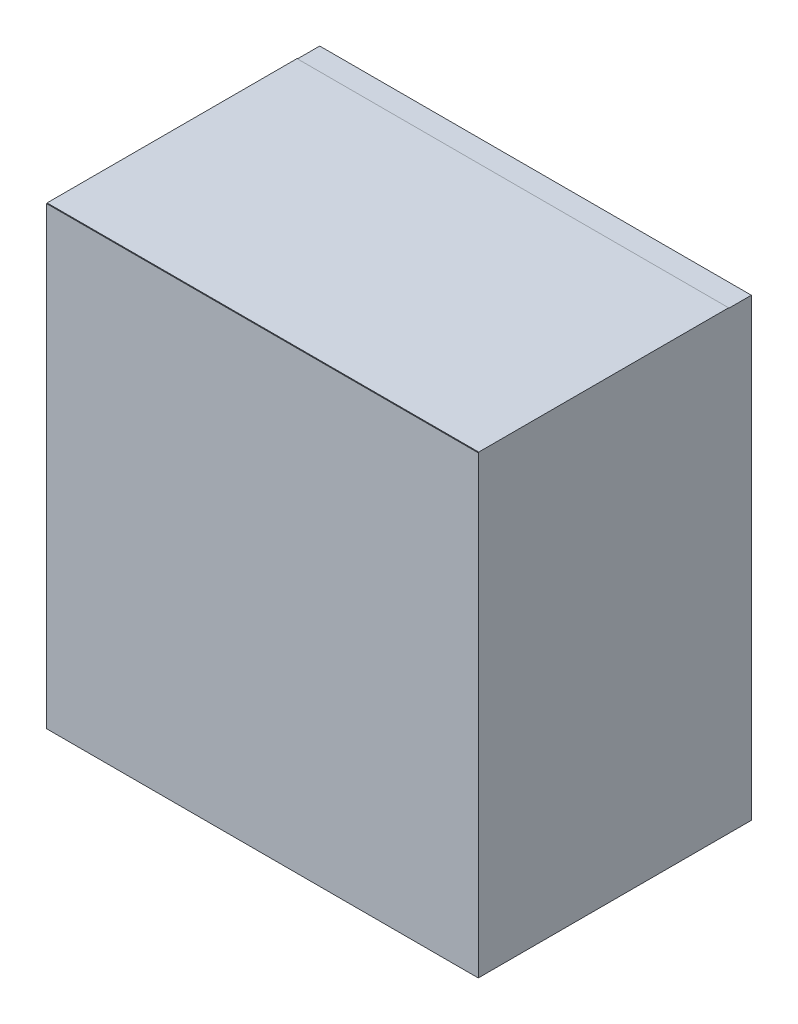
from build123d import *

# Parameters (mm, degrees)
SKETCH_1_W      = 950
SKETCH_1_H      = 550
EXTRUDE_1_DEPTH = 1
SKETCH_2_W      = 950
SKETCH_2_H      = 550
EXTRUDE_2_DEPTH = 1
SKETCH_3_W      = 950
SKETCH_3_H      = 1001
EXTRUDE_3_DEPTH = 1
SKETCH_3_2_W    = 950
SKETCH_3_2_H    = 1001
EXTRUDE_4_DEPTH = 600


with BuildPart() as part:
    # 草图1 → 凸台-拉伸1 (new body)
    with BuildSketch(Plane(origin=(0, 0, 0), x_dir=(1, 0, 0), z_dir=(0, 1, 0))):
        with Locations((-475, 275)):
            Rectangle(SKETCH_1_W, SKETCH_1_H)
    extrude(amount=EXTRUDE_1_DEPTH)

    # 草图3 → 凸台-拉伸3 (add)
    with BuildSketch(Plane.XY):
        with Locations((-475, 500.5)):
            Rectangle(SKETCH_3_W, SKETCH_3_H)
    extrude(amount=EXTRUDE_3_DEPTH)



with BuildPart() as body_2:
    # 草图2 → 凸台-拉伸2 (new body)
    with BuildSketch(Plane(origin=(0, 1001, 0), x_dir=(1, 0, 0), z_dir=(0, 1, 0))):
        with Locations((-475, 275)):
            Rectangle(SKETCH_2_W, SKETCH_2_H)
    extrude(amount=EXTRUDE_2_DEPTH)


with BuildPart() as part_1:
    add(part.part)

    add(body_2.part)  # 凸台-拉伸4 merges body 2
    # 草图3<2> → 凸台-拉伸4 (add)
    with BuildSketch(Plane.XY):
        with Locations((-475, 500.5)):
            Rectangle(SKETCH_3_2_W, SKETCH_3_2_H)
    extrude(amount=-EXTRUDE_4_DEPTH)


solid = part_1.part
